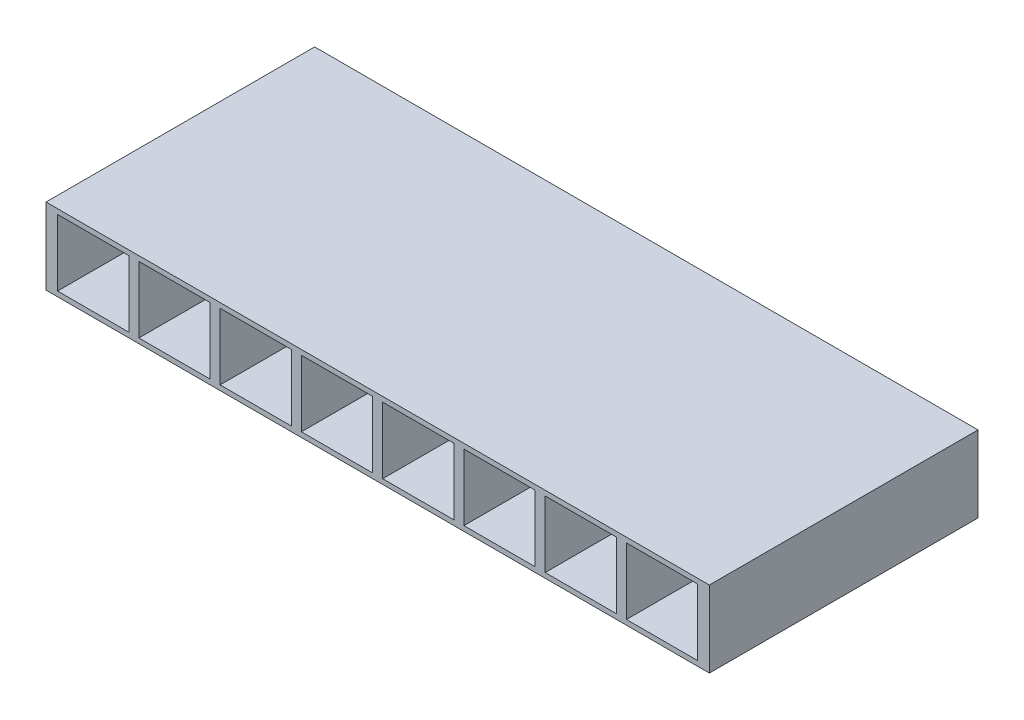
from build123d import *

# Parameters (mm, degrees)
ESQUISSE1_W        = 20
ESQUISSE1_H        = 2.3
ESQUISSE1_W_2      = 2.15
ESQUISSE1_H_2      = 2
BOSS_EXTRU_2_DEPTH = 8.1


with BuildPart() as part:
    # Esquisse1 → Boss.-Extru.2 (new body)
    with BuildSketch(Plane.XY):
        with Locations((2.5, 0)):
            Rectangle(ESQUISSE1_W, ESQUISSE1_H)
        with Locations((-3.625, 0)):
            Rectangle(ESQUISSE1_W_2, ESQUISSE1_H_2, mode=Mode.SUBTRACT)
        with Locations((-6.075, 0)):
            Rectangle(ESQUISSE1_W_2, ESQUISSE1_H_2, mode=Mode.SUBTRACT)
        with Locations((-1.175, 0)):
            Rectangle(ESQUISSE1_W_2, ESQUISSE1_H_2, mode=Mode.SUBTRACT)
        with Locations((1.275, 0)):
            Rectangle(ESQUISSE1_W_2, ESQUISSE1_H_2, mode=Mode.SUBTRACT)
        with Locations((3.725, 0)):
            Rectangle(ESQUISSE1_W_2, ESQUISSE1_H_2, mode=Mode.SUBTRACT)
        with Locations((6.175, 0)):
            Rectangle(ESQUISSE1_W_2, ESQUISSE1_H_2, mode=Mode.SUBTRACT)
        with Locations((8.625, 0)):
            Rectangle(ESQUISSE1_W_2, ESQUISSE1_H_2, mode=Mode.SUBTRACT)
        with Locations((11.075, 0)):
            Rectangle(ESQUISSE1_W_2, ESQUISSE1_H_2, mode=Mode.SUBTRACT)
    extrude(amount=BOSS_EXTRU_2_DEPTH)


solid = part.part
